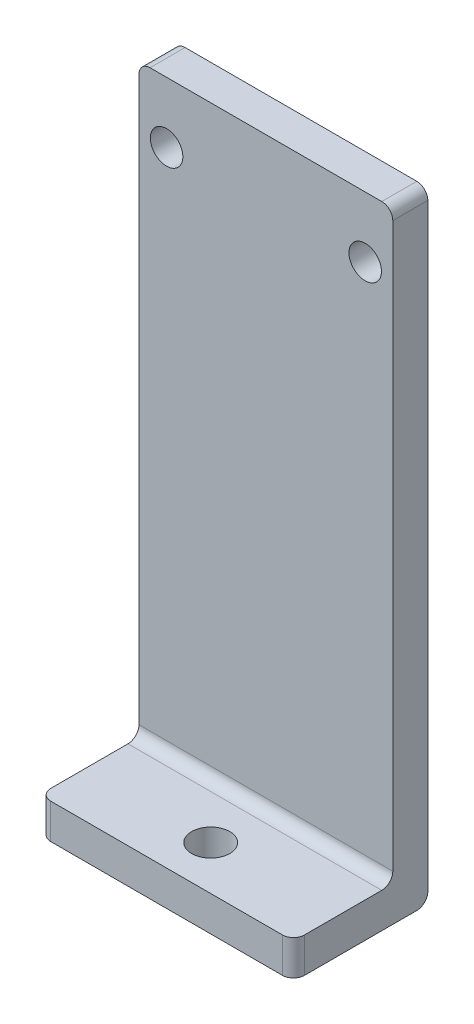
from build123d import *

# Parameters (mm, degrees)
SKETCH1_W             = 23
SKETCH1_H             = 53.06
SKETCH1_R             = 1.4732
SKETCH1_H_2           = 3.175
BOSS_EXTRUDE1_DEPTH   = 3.175
BOSS_EXTRUDE2_START   = 3.175
SKETCH1_3_W           = 23
SKETCH1_3_H           = 3.175
BOSS_EXTRUDE2_DEPTH   = 9
F_8_32_TAPPED_HOLE1_D = 3.4544
FILLET1_R             = 1


with BuildPart() as part:
    # Sketch1 → Boss-Extrude1 (new body)
    # profile 1 of 2: a face of its own
    with BuildSketch(Plane.XY):
        with Locations((11.5, -26.53)):
            Rectangle(SKETCH1_W, SKETCH1_H)
        with Locations((2.5, -5.5)):
            Circle(SKETCH1_R, mode=Mode.SUBTRACT)
        with Locations((20.5, -5.5)):
            Circle(SKETCH1_R, mode=Mode.SUBTRACT)
    # profile 2 of 2: a face of its own
    with BuildSketch(Plane.XY):
        with Locations((11.5, -54.6475)):
            Rectangle(SKETCH1_W, SKETCH1_H_2)
    extrude(amount=BOSS_EXTRUDE1_DEPTH)

    # Sketch1<3> → Boss-Extrude2 (add)
    with BuildSketch(Plane.XY.offset(BOSS_EXTRUDE2_START)):
        with Locations((11.5, -54.6475)):
            Rectangle(SKETCH1_3_W, SKETCH1_3_H)
    extrude(amount=BOSS_EXTRUDE2_DEPTH)

    # #8-32 Tapped Hole1 (through all)
    with Locations(Plane(origin=(11.5, -53.06, 8.175), x_dir=(0, 0, 1), z_dir=(0, 1, 0))):
        with Locations((0, 0)):
            Hole(F_8_32_TAPPED_HOLE1_D / 2)

    # Fillet1
    fillet1_edges = [part.edges().sort_by_distance(p)[0] for p in [
        (0, 0, 1.5875),
        (23, 0, 1.5875),
        (0, -54.6475, 12.175),
        (11.5, -53.06, 3.175),
        (23, -54.6475, 12.175),
        (11.5, -56.235, 0),
    ]]
    fillet(fillet1_edges, radius=FILLET1_R)


solid = part.part
